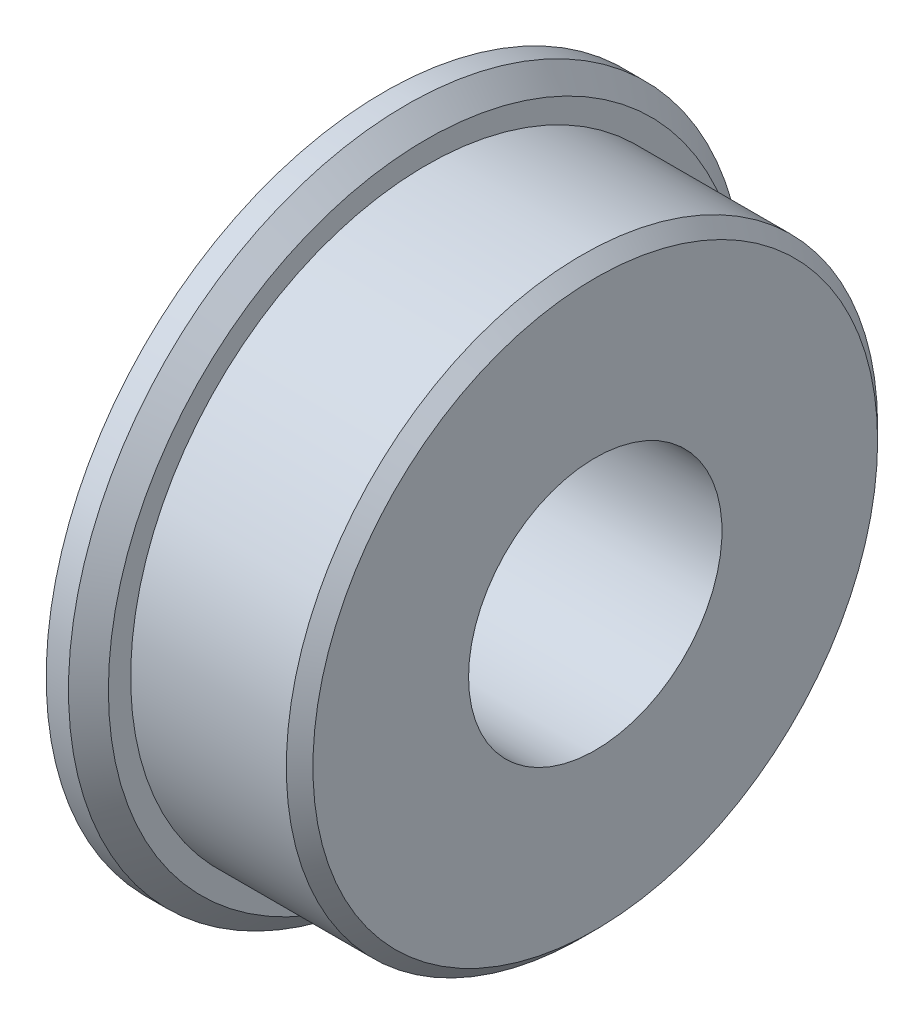
from build123d import *

# Parameters (mm, degrees)
SKETCH1_R           = 25.4
BOSS_EXTRUDE1_DEPTH = 3.175
SKETCH2_R           = 22.225
BOSS_EXTRUDE2_DEPTH = 12.7
SKETCH3_R           = 9.525
CUT_EXTRUDE1_DEPTH  = 40.272581084
CHAMFER1_SIZE       = 1.5
CHAMFER2_SIZE       = 1


with BuildPart() as part:
    # Sketch1 → Boss-Extrude1 (new body)
    with BuildSketch(Plane(origin=(0, 0, 0), x_dir=(0, 0, -1), z_dir=(1, 0, 0))):
        Circle(SKETCH1_R)
    extrude(amount=BOSS_EXTRUDE1_DEPTH)

    # Sketch2 → Boss-Extrude2 (add)
    with BuildSketch(Plane(origin=(3.175, 0, 0), x_dir=(0, 0, -1), z_dir=(1, 0, 0))):
        Circle(SKETCH2_R)
    extrude(amount=BOSS_EXTRUDE2_DEPTH)

    # Sketch3 → Cut-Extrude1 (cut, through all)
    with BuildSketch(Plane.ZY):
        Circle(SKETCH3_R)
    extrude(amount=-CUT_EXTRUDE1_DEPTH, mode=Mode.SUBTRACT)

    # Chamfer1
    chamfer1_edges = [part.edges().sort_by_distance(p)[0] for p in [
        (3.175, 0, 25.4),
    ]]
    chamfer(chamfer1_edges, length=CHAMFER1_SIZE)

    # Chamfer2
    chamfer2_edges = [part.edges().sort_by_distance(p)[0] for p in [
        (15.875, 0, 22.225),
    ]]
    chamfer(chamfer2_edges, length=CHAMFER2_SIZE)


solid = part.part
